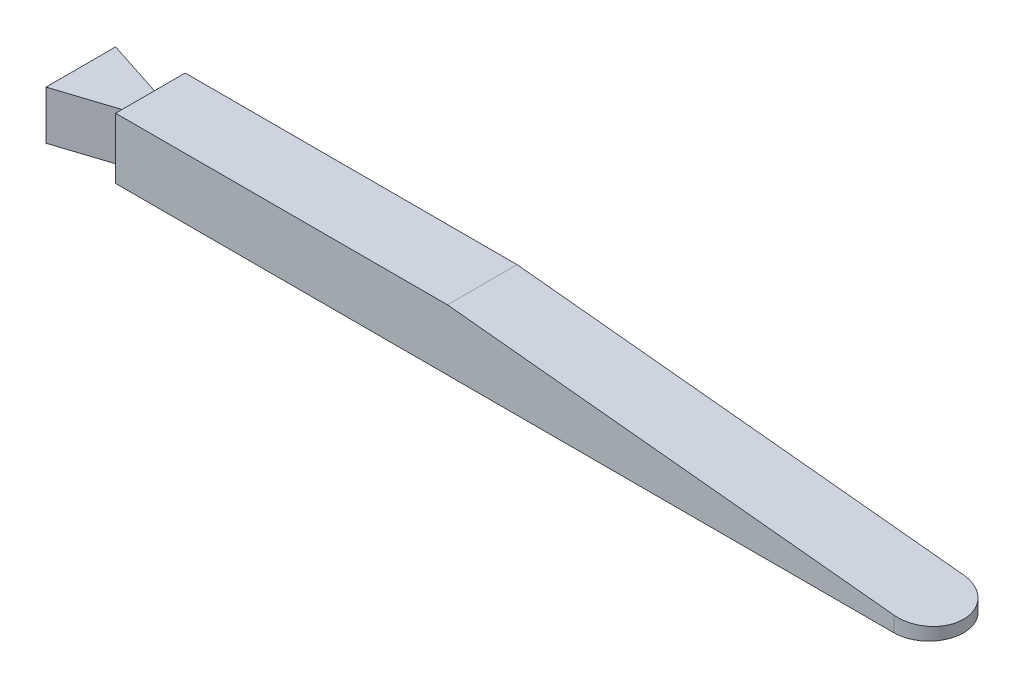
from build123d import *

# Parameters (mm, degrees)
BOSS_EXTRUDE1_DEPTH = 31.75
CUT_EXTRUDE2_DEPTH  = 442.504730683
CUT_EXTRUDE4_DEPTH  = 6.35


with BuildPart() as part:
    # Sketch2 → Boss-Extrude1 (new body)
    with BuildSketch(Plane(origin=(0, 0, 0), x_dir=(1, 0, 0), z_dir=(0, 1, 0))):
        with BuildLine():
            Line((14.300231201, -2.54), (420.689751691, -2.54))
            ThreePointArc((420.689751691, -2.54), (438.859641691, -20.70989), (420.689751691, -38.87978))
            Line((420.689751691, -38.87978), (14.300231201, -38.87978))
            Line((14.300231201, -38.87978), (14.300231201, -27.119548799))
            Line((14.300231201, -27.119548799), (-22.039548799, -38.87978))
            Line((-22.039548799, -38.87978), (-22.039548799, -2.54))
            Line((-22.039548799, -2.54), (14.300231201, -14.300231201))
            Line((14.300231201, -14.300231201), (14.300231201, -2.54))
        make_face()
    extrude(amount=BOSS_EXTRUDE1_DEPTH)

    # Sketch4 → Cut-Extrude2 (cut, through all)
    with BuildSketch(Plane.XY.offset(38.87978)):
        Polygon((187.5733876, 31.75), (438.859641691, 31.75), (438.859641691, 6.151225872), align=None)
    extrude(amount=-CUT_EXTRUDE2_DEPTH, mode=Mode.SUBTRACT)

    # Sketch8 → Cut-Extrude4 (cut)
    with BuildSketch(Plane(origin=(0, 31.75, 0), x_dir=(1, 0, 0), z_dir=(0, 1, 0))):
        Polygon((-22.039548799, -2.54), (14.300231201, -14.300231201), (14.300231201, -27.119548799), (-22.039548799, -38.87978), align=None)
    extrude(amount=-CUT_EXTRUDE4_DEPTH, mode=Mode.SUBTRACT)


solid = part.part
